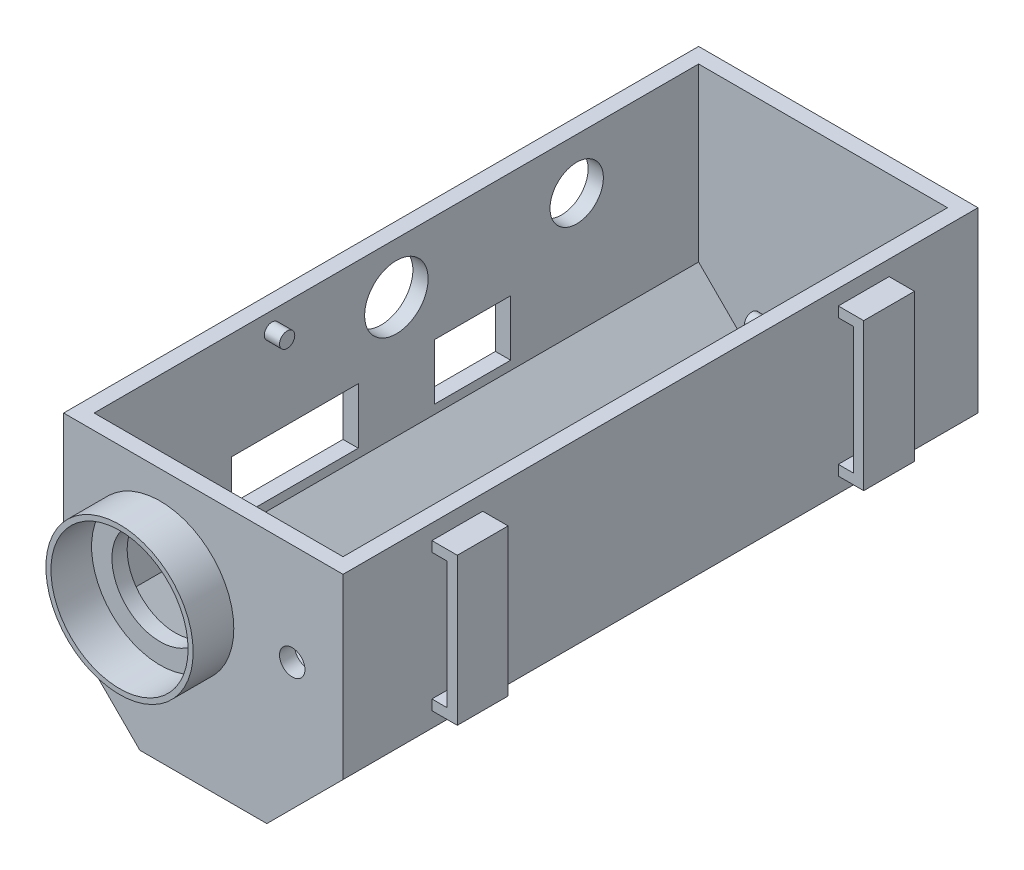
from build123d import *

# Parameters (mm, degrees)
SKETCH1_W               = 55
SKETCH1_H               = 125
BOSS_EXTRUDE1_DEPTH     = 50
FILLET1_SIZE            = 15
CHAMFER1_SIZE           = 15
SHELL1_T                = -3
SKETCH11_W              = 10
SKETCH11_H              = 29
BOSS_EXTRUDE3_DEPTH     = 5
CUT_EXTRUDE2_DEPTH      = 133.876822659
CUT_EXTRUDE2_DEPTH_BACK = 133.876822659
SKETCH12_W              = 3
SKETCH12_H              = 25
SKETCH31_R              = 14.5
BOSS_EXTRUDE10_DEPTH    = 8
SKETCH32_R              = 13.5
CUT_EXTRUDE11_DEPTH     = 8
SKETCH33_R              = 9.5
CUT_EXTRUDE12_DEPTH     = 20
SKETCH34_R              = 2.5
CUT_EXTRUDE15_DEPTH     = 5
SKETCH39_W              = 15
SKETCH39_H              = 11
SKETCH39_W_2            = 25
CUT_EXTRUDE16_DEPTH     = 10
SKETCH41_R              = 6.25
SKETCH41_R_2            = 5.25
CUT_EXTRUDE17_DEPTH     = 10
SKETCH44_R              = 1.5
BOSS_EXTRUDE11_DEPTH    = 3
SKETCH45_R              = 1.5
BOSS_EXTRUDE12_DEPTH    = 3.5


with BuildPart() as part:
    # Sketch1 → Boss-Extrude1 (new body)
    with BuildSketch(Plane(origin=(0, 0, 0), x_dir=(1, 0, 0), z_dir=(0, 1, 0))):
        with Locations((27.5, -62.5)):
            Rectangle(SKETCH1_W, SKETCH1_H)
    extrude(amount=BOSS_EXTRUDE1_DEPTH)

    # Fillet1
    fillet1_edges = [part.edges().sort_by_distance(p)[0] for p in [
        (55, 0, 62.5),
    ]]
    chamfer(fillet1_edges, length=FILLET1_SIZE)

    # Chamfer1
    chamfer1_edges = [part.edges().sort_by_distance(p)[0] for p in [
        (0, 0, 62.5),
    ]]
    chamfer(chamfer1_edges, length=CHAMFER1_SIZE)

    # Shell1
    shell1_openings = [part.faces().sort_by_distance(p)[0] for p in [
        (27.5, 50, 62.5),
    ]]
    offset(amount=SHELL1_T, openings=shell1_openings, kind=Kind.INTERSECTION)

    # Sketch11 → Boss-Extrude3 (add)
    with BuildSketch(Plane(origin=(55, 0, 0), x_dir=(0, 0, -1), z_dir=(1, 0, 0))):
        with Locations((-102.5, 32.5)):
            Rectangle(SKETCH11_W, SKETCH11_H)
        with Locations((-22.5, 32.5)):
            Rectangle(SKETCH11_W, SKETCH11_H)
    extrude(amount=BOSS_EXTRUDE3_DEPTH)

    # Sketch12 → Cut-Extrude2 (cut, two sides: drawn at the far end of the back side and taken through both)
    with BuildSketch(Plane.XY.offset(107.5).offset(-CUT_EXTRUDE2_DEPTH_BACK)):
        with Locations((56.5, 32.5)):
            Rectangle(SKETCH12_W, SKETCH12_H)
    extrude(amount=CUT_EXTRUDE2_DEPTH + CUT_EXTRUDE2_DEPTH_BACK, mode=Mode.SUBTRACT)

    # Sketch31 → Boss-Extrude10 (add)
    with BuildSketch(Plane.XY.offset(125)):
        with Locations((19, 30)):
            Circle(SKETCH31_R)
    extrude(amount=BOSS_EXTRUDE10_DEPTH)

    # Sketch32 → Cut-Extrude11 (cut)
    with BuildSketch(Plane.XY.offset(133)):
        with Locations((19, 30)):
            Circle(SKETCH32_R)
    extrude(amount=-CUT_EXTRUDE11_DEPTH, mode=Mode.SUBTRACT)

    # Sketch33 → Cut-Extrude12 (cut)
    with BuildSketch(Plane.XY.offset(125)):
        with Locations((19, 30)):
            Circle(SKETCH33_R)
    extrude(amount=-CUT_EXTRUDE12_DEPTH, mode=Mode.SUBTRACT)

    # Sketch34 → Cut-Extrude15 (cut)
    with BuildSketch(Plane.XY.offset(125)):
        with Locations((45, 30)):
            Circle(SKETCH34_R)
    extrude(amount=-CUT_EXTRUDE15_DEPTH, mode=Mode.SUBTRACT)

    # Sketch39 → Cut-Extrude16 (cut)
    with BuildSketch(Plane.ZY):
        with Locations((47.5, 23.5)):
            Rectangle(SKETCH39_W, SKETCH39_H)
        with Locations((82.5, 23.5)):
            Rectangle(SKETCH39_W_2, SKETCH39_H)
    extrude(amount=-CUT_EXTRUDE16_DEPTH, mode=Mode.SUBTRACT)

    # Sketch41 → Cut-Extrude17 (cut)
    with BuildSketch(Plane.ZY):
        with Locations((62.5, 40)):
            Circle(SKETCH41_R)
        with Locations((27, 40)):
            Circle(SKETCH41_R_2)
    extrude(amount=-CUT_EXTRUDE17_DEPTH, mode=Mode.SUBTRACT)

    # Sketch44 → Boss-Extrude11 (add)
    with BuildSketch(Plane(origin=(3, 0, 0), x_dir=(0, 0, -1), z_dir=(1, 0, 0))):
        with Locations((-87, 46.5)):
            Circle(SKETCH44_R)
    extrude(amount=BOSS_EXTRUDE11_DEPTH)

    # Sketch45 → Boss-Extrude12 (add)
    with BuildSketch(Plane.ZY.offset(-52)):
        with Locations((38, 46.5)):
            Circle(SKETCH45_R)
    extrude(amount=BOSS_EXTRUDE12_DEPTH)


solid = part.part
